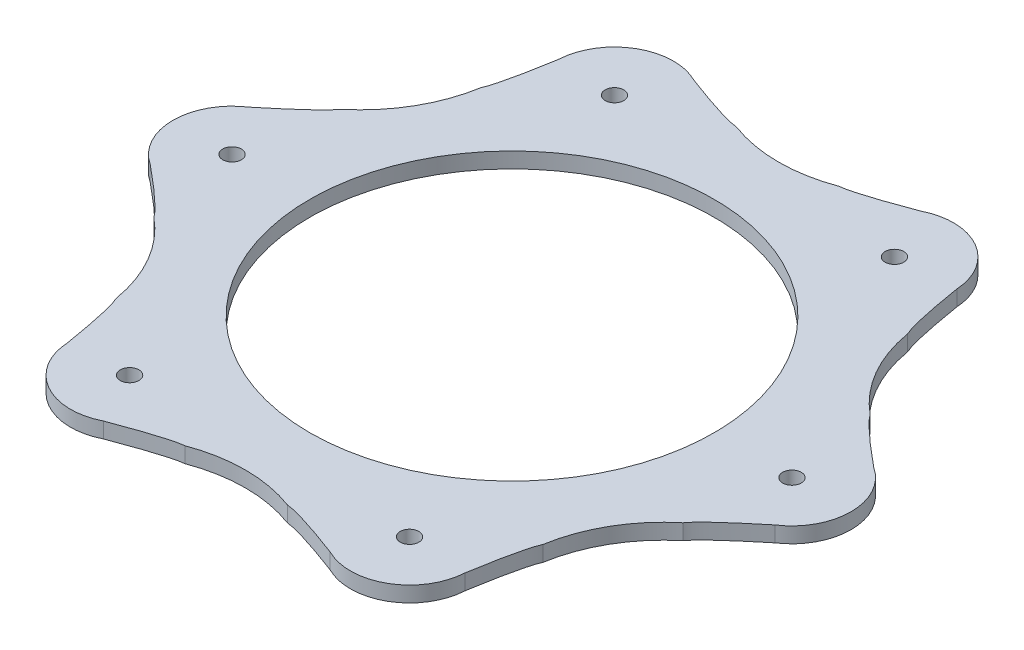
from build123d import *

# Parameters (mm, degrees)
SKETCH1_R           = 45
SKETCH1_R_2         = 32.5
BOSS_EXTRUDE2_DEPTH = 2.5
BOSS_EXTRUDE4_START = -2.5
BOSS_EXTRUDE4_DEPTH = 2.5
CIRPATTERN1_COUNT   = 6
CUT_EXTRUDE2_DEPTH  = 2.5
SKETCH6_R           = 1.5
CUT_EXTRUDE3_DEPTH  = 5


with BuildPart() as part:
    # Sketch1 → Boss-Extrude2 (new body)
    with BuildSketch(Plane(origin=(0, 0, 0), x_dir=(1, 0, 0), z_dir=(0, 1, 0))):
        with Locations(Location((0, 0, 0), (0, 0, 270))):
            Circle(SKETCH1_R)
        with Locations(Location((0, 0, 0), (0, 0, 270))):
            Circle(SKETCH1_R_2, mode=Mode.SUBTRACT)
    extrude(amount=BOSS_EXTRUDE2_DEPTH)

    # Sketch2 → Boss-Extrude4 (add)
    with BuildSketch(Plane(origin=(0, 2.5, 0), x_dir=(1, 0, 0), z_dir=(0, 1, 0)).offset(BOSS_EXTRUDE4_START)):
        with BuildLine():
            ThreePointArc((-42.23454554, 15.532004475), (-45, 0), (-42.23454554, -15.532004475))
            add(Edge.make_bspline(
                [(-50.212380227, -7.942360629), (-45.3159648, -11.95963121), (-42.656686571, -14.489512492), (-42.23454554, -15.532004475)],
                knots=[0.089311832, 0.089311832, 0.089311832, 0.089311832, 1, 1, 1, 1], degree=3))
            ThreePointArc((-50.212380227, -7.942360629), (-54.5, 0), (-50.212380227, 7.942360629))
            add(Edge.make_bspline(
                [(-50.212380227, 7.942360629), (-45.3159648, 11.95963121), (-42.656686571, 14.489512492), (-42.23454554, 15.532004475)],
                knots=[0.089311832, 0.089311832, 0.089311832, 0.089311832, 1, 1, 1, 1], degree=3))
        make_face()
    boss_extrude4 = extrude(amount=BOSS_EXTRUDE4_DEPTH)

    # CirPattern1: Boss-Extrude4 ×6 about axis
    cirpattern1_axis = Axis((0, 2.5, 0), (0, 1, 0))
    for i in range(1, CIRPATTERN1_COUNT):
        add(boss_extrude4.rotate(cirpattern1_axis, i * 360 / CIRPATTERN1_COUNT))

    # Sketch5 → Cut-Extrude2 (cut)
    with BuildSketch(Plane(origin=(0, 2.5, 0), x_dir=(1, 0, 0), z_dir=(0, 1, 0))):
        with BuildLine():
            Line((-8.22468756, 44.342191593), (0, 46.65782144))
            Line((0, 46.65782144), (8.22468756, 44.342191593))
            ThreePointArc((8.22468756, 44.342191593), (0, 42.851652617), (-8.22468756, 44.342191593))
        make_face()
        with BuildLine():
            Line((40.406858652, 23.32891072), (42.513808159, 15.048307431))
            ThreePointArc((42.513808159, 15.048307431), (37.11061976, 21.425826308), (34.289120599, 29.293884161))
            Line((34.289120599, 29.293884161), (40.406858652, 23.32891072))
        make_face()
        with BuildLine():
            Line((40.406858652, -23.32891072), (34.289120599, -29.293884161))
            ThreePointArc((34.289120599, -29.293884161), (37.11061976, -21.425826308), (42.513808159, -15.048307431))
            Line((42.513808159, -15.048307431), (40.406858652, -23.32891072))
        make_face()
        with BuildLine():
            Line((0, -46.65782144), (-8.22468756, -44.342191593))
            ThreePointArc((-8.22468756, -44.342191593), (0, -42.851652617), (8.22468756, -44.342191593))
            Line((8.22468756, -44.342191593), (0, -46.65782144))
        make_face()
        with BuildLine():
            Line((-40.406858652, -23.32891072), (-42.513808159, -15.048307431))
            ThreePointArc((-42.513808159, -15.048307431), (-37.11061976, -21.425826308), (-34.289120599, -29.293884161))
            Line((-34.289120599, -29.293884161), (-40.406858652, -23.32891072))
        make_face()
        with BuildLine():
            Line((-40.406858652, 23.32891072), (-34.289120599, 29.293884161))
            ThreePointArc((-34.289120599, 29.293884161), (-37.11061976, 21.425826308), (-42.513808159, 15.048307431))
            Line((-42.513808159, 15.048307431), (-40.406858652, 23.32891072))
        make_face()
    extrude(amount=-CUT_EXTRUDE2_DEPTH, mode=Mode.SUBTRACT)

    # Sketch6 → Cut-Extrude3 (cut, symmetric)
    with BuildSketch(Plane(origin=(0, 2.5, 0), x_dir=(1, 0, 0), z_dir=(0, 1, 0))):
        with Locations(Location((-45, 0, 0), (0, 0, 270))):
            Circle(SKETCH6_R)
        with Locations(Location((-22.5, 38.97114317, 0), (0, 0, 270))):
            Circle(SKETCH6_R)
        with Locations(Location((22.5, 38.97114317, 0), (0, 0, 270))):
            Circle(SKETCH6_R)
        with Locations(Location((45, 0, 0), (0, 0, 270))):
            Circle(SKETCH6_R)
        with Locations(Location((22.5, -38.97114317, 0), (0, 0, 270))):
            Circle(SKETCH6_R)
        with Locations(Location((-22.5, -38.97114317, 0), (0, 0, 270))):
            Circle(SKETCH6_R)
    extrude(amount=CUT_EXTRUDE3_DEPTH, both=True, mode=Mode.SUBTRACT)


solid = part.part
